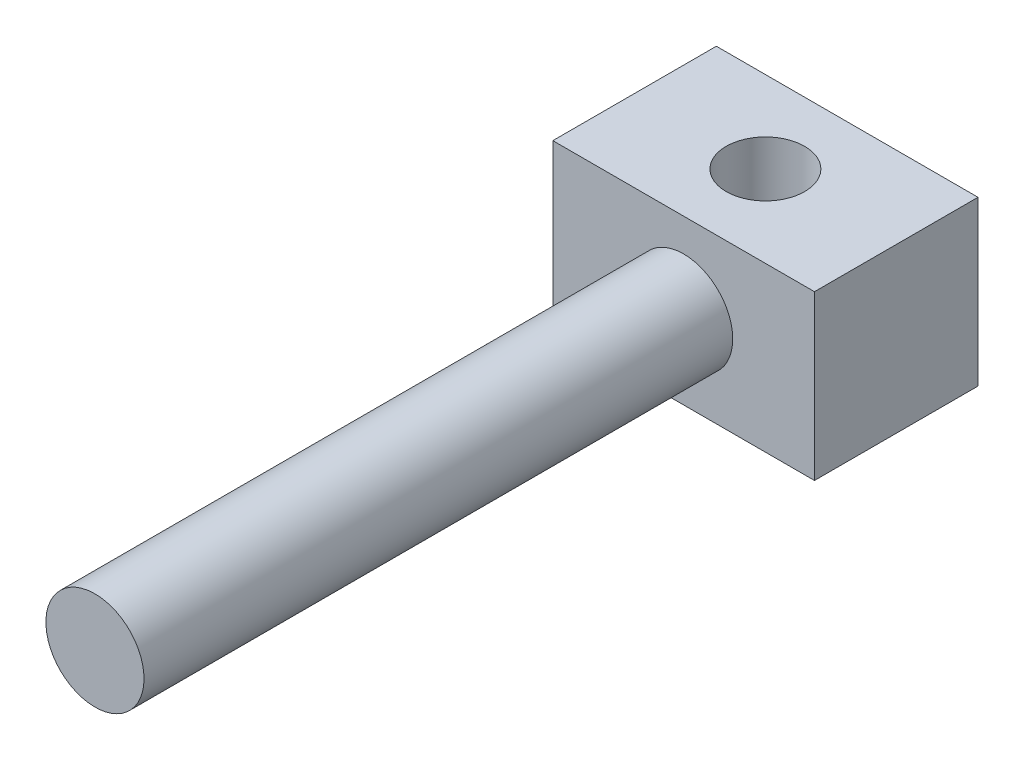
from build123d import *
from build123d.topology import SkipClean

# Parameters (mm, degrees)
SKETCH1_W           = 8
SKETCH1_H           = 5
BOSS_EXTRUDE1_DEPTH = 2.5
SKETCH2_W           = 3
SKETCH2_H           = 3
BOSS_EXTRUDE2_DEPTH = 1.5
CUT_EXTRUDE2_DEPTH  = 3
SKETCH5_R           = 1.2
CUT_EXTRUDE3_DEPTH  = 9.440971508
BOSS_EXTRUDE3_START = 15
SKETCH6_R           = 1.5
BOSS_EXTRUDE3_DEPTH = 15


with BuildPart() as part:
    # Sketch1 → Boss-Extrude1 (new, symmetric)
    with BuildSketch(Plane(origin=(0, 0, 0), x_dir=(1, 0, 0), z_dir=(0, 1, 0))):
        Rectangle(SKETCH1_W, SKETCH1_H)
    extrude(amount=BOSS_EXTRUDE1_DEPTH, both=True)

    # Sketch2 → Boss-Extrude2 (add, symmetric)
    with BuildSketch(Plane(origin=(0, 0, 0), x_dir=(1, 0, 0), z_dir=(0, 1, 0))):
        with Locations((0, -4)):
            Rectangle(SKETCH2_W, SKETCH2_H)
    extrude(amount=BOSS_EXTRUDE2_DEPTH, both=True)

    # Sketch3 → Cut-Extrude2 (cut)
    with BuildSketch(Plane.XY.offset(5.5)):
        with BuildLine():
            Line((-1.5, 1.5), (-1.5, 0))
            ThreePointArc((-1.5, 0), (-1.060660172, 1.060660172), (0, 1.5))
            Line((0, 1.5), (-1.5, 1.5))
        make_face()
        with BuildLine():
            ThreePointArc((0, 1.5), (1.060660172, 1.060660172), (1.5, 0))
            Line((1.5, 0), (1.5, 1.5))
            Line((1.5, 1.5), (0, 1.5))
        make_face()
        with BuildLine():
            ThreePointArc((1.5, 0), (1.060660172, -1.060660172), (0, -1.5))
            Line((0, -1.5), (1.5, -1.5))
            Line((1.5, -1.5), (1.5, 0))
        make_face()
        with BuildLine():
            Line((-1.5, 0), (-1.5, -1.5))
            Line((-1.5, -1.5), (0, -1.5))
            ThreePointArc((0, -1.5), (-1.060660172, -1.060660172), (-1.5, 0))
        make_face()
    extrude(amount=-CUT_EXTRUDE2_DEPTH, mode=Mode.SUBTRACT)

    # Sketch5 → Cut-Extrude3 (cut, through all)
    with BuildSketch(Plane(origin=(0, 2.5, 0), x_dir=(1, 0, 0), z_dir=(0, 1, 0))):
        with Locations(Location((0, 0, 0), (0, 0, 270))):
            Circle(SKETCH5_R)
    extrude(amount=-CUT_EXTRUDE3_DEPTH, mode=Mode.SUBTRACT)

    # Sketch6 → Boss-Extrude3 (add)
    with SkipClean():  # the faces are left unmerged after this step: merging them gives an invalid solid
        with BuildSketch(Plane.XY.offset(5.5).offset(BOSS_EXTRUDE3_START)):
            Circle(SKETCH6_R)
        extrude(amount=-BOSS_EXTRUDE3_DEPTH)


solid = part.part
